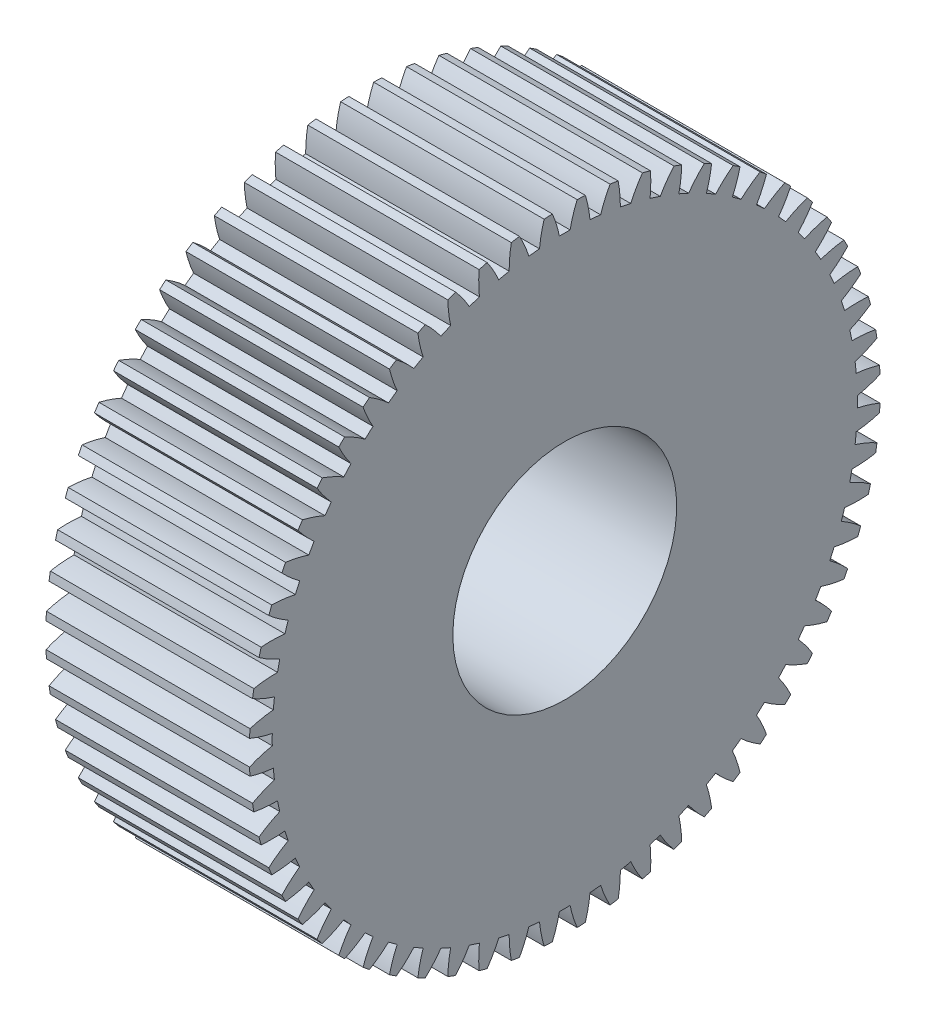
from build123d import *

# Parameters (mm, degrees)
BASPROSKE_W     = 10
BASPROSKE_H     = 15.5
TOOTHCUT_DEPTH  = 25.093567606
TEETHCUTS_COUNT = 60
TEETHCUTS_ANGLE = 354
BORSKE_R        = 5.5
BORE_DEPTH      = 50.0000508


with BuildPart() as part:
    # BasProSke → Base-Revolve (revolve)
    with BuildSketch(Plane(origin=(0, 0, 0), x_dir=(1, 0, 0), z_dir=(0, 1, 0)), mode=Mode.PRIVATE) as base_revolve_sk:
        with Locations((5, 7.75)):
            Rectangle(BASPROSKE_W, BASPROSKE_H)
    revolve(base_revolve_sk.sketch.rotate(Axis((-10, 0, 0), (1, 0, 0)), 180), axis=Axis((-10, 0, 0), (1, 0, 0)))

    # TooCutSke → ToothCut (cut, through all)
    with BuildSketch(Plane(origin=(0, 0, 0), x_dir=(0, 0, -1), z_dir=(1, 0, 0))):
        with BuildLine():
            ThreePointArc((0.262448686, 14.371603831), (0, 14.374), (-0.262448686, 14.371603831))
            ThreePointArc((-0.262448686, 14.371603831), (-0.412372136, 14.951236823), (-0.61931566, 15.513042683))
            ThreePointArc((-0.61931566, 15.513042683), (0, 15.5254), (0.61931566, 15.513042683))
            ThreePointArc((0.61931566, 15.513042683), (0.412372136, 14.951236823), (0.262448686, 14.371603831))
        make_face()
    toothcut = extrude(amount=TOOTHCUT_DEPTH, mode=Mode.SUBTRACT)

    # TeethCuts: ToothCut ×60 about axis
    teethcuts_axis = Axis((-10, 0, 0), (1, 0, 0))
    for i in range(1, TEETHCUTS_COUNT):
        add(toothcut.rotate(teethcuts_axis, i * TEETHCUTS_ANGLE / (TEETHCUTS_COUNT - 1)), mode=Mode.SUBTRACT)

    # BorSke → Bore (cut, symmetric)
    with BuildSketch(Plane(origin=(0, 0, 0), x_dir=(0, 0, -1), z_dir=(1, 0, 0))):
        with Locations(Location((0, 0, 0), (0, 0, 180))):
            Circle(BORSKE_R)
    extrude(amount=BORE_DEPTH, both=True, mode=Mode.SUBTRACT)


solid = part.part
